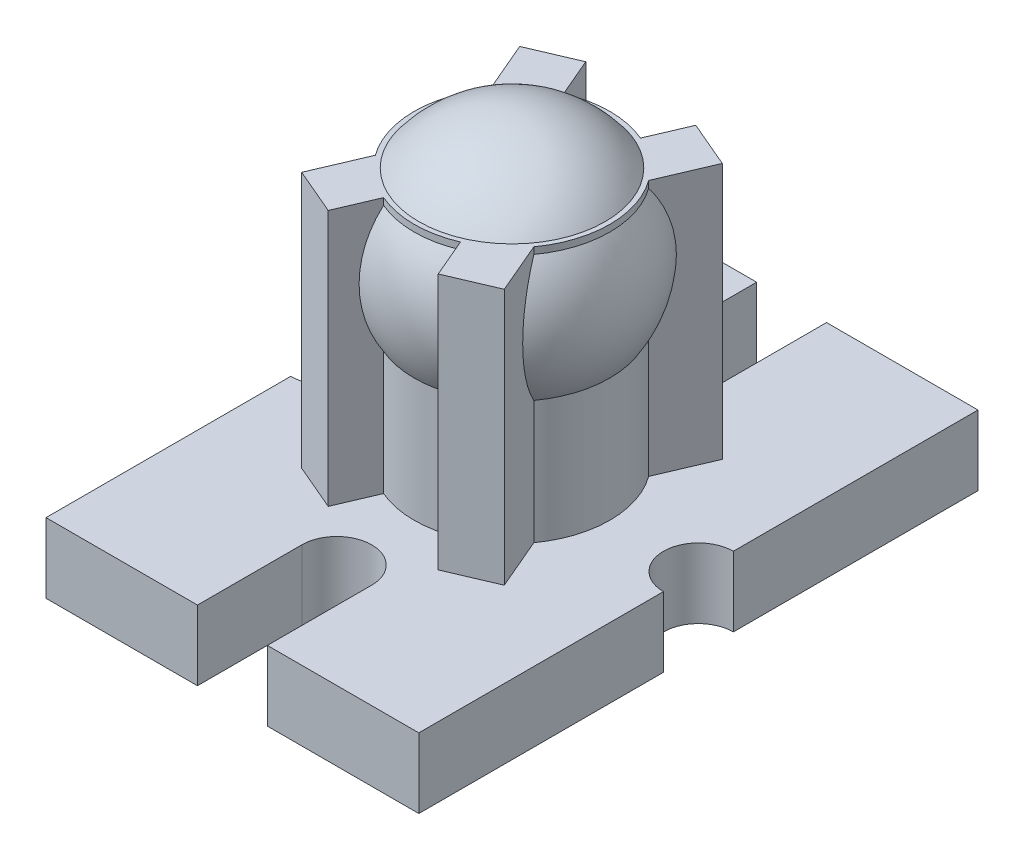
from build123d import *

# Parameters (mm, degrees)
EXTRUDE_1_DEPTH = 3
EXTRUDE_2_DEPTH = 11


with BuildPart() as part:
    # 草图1 → 凸台-拉伸1 (new body)
    with BuildSketch(Plane(origin=(0, 0, 0), x_dir=(1, 0, 0), z_dir=(0, 1, 0))):
        with BuildLine():
            Line((1.5, 12), (8, 12))
            Line((8, 12), (8, 1.5))
            ThreePointArc((8, 1.5), (6.5, 0), (8, -1.5))
            Line((8, -1.5), (8, -12))
            Line((8, -12), (1.5, -12))
            Line((1.5, -12), (1.5, -7.52))
            ThreePointArc((1.5, -7.52), (0, -6.02), (-1.5, -7.52))
            Line((-1.5, -7.52), (-1.5, -12))
            Line((-1.5, -12), (-8, -12))
            Line((-8, -12), (-8, -1.5))
            ThreePointArc((-8, -1.5), (-6.5, 0), (-8, 1.5))
            Line((-8, 1.5), (-8, 12))
            Line((-8, 12), (-1.5, 12))
            Line((-1.5, 12), (-1.5, 7.52))
            ThreePointArc((-1.5, 7.52), (0, 6.02), (1.5, 7.52))
            Line((1.5, 7.52), (1.5, 12))
        make_face()
    extrude(amount=EXTRUDE_1_DEPTH)



with BuildPart() as body_2:
    # 草图2 → 旋转1 (revolve)
    with BuildSketch(Plane(origin=(0, 0, 0), x_dir=(0, 0, -1), z_dir=(1, 0, 0))):
        with BuildLine():
            Line((0, 16), (0, 6))
            ThreePointArc((0, 6), (5, 11), (0, 16))
        make_face()
    revolve(axis=Axis((0, 3, 0), (0, 1, 0)))


with BuildPart() as part_1:
    add(part.part)

    add(body_2.part)  # 凸台-拉伸2 merges body 2
    # 草图3 → 凸台-拉伸2 (add)
    with BuildSketch(Plane(origin=(0, 3, 0), x_dir=(1, 0, 0), z_dir=(0, 1, 0))):
        with BuildLine():
            Line((1.649838457, 3.862386965), (2.360840268, 5.526891824))
            Line((2.360840268, 5.526891824), (4.347210707, 4.678403474))
            Line((4.347210707, 4.678403474), (3.401303107, 2.46396777))
            ThreePointArc((3.401303107, 2.46396777), (4.2, 0), (3.401303107, -2.46396777))
            Line((3.401303107, -2.46396777), (4.347210707, -4.678403474))
            Line((4.347210707, -4.678403474), (2.360840268, -5.526891824))
            Line((2.360840268, -5.526891824), (1.649838457, -3.862386965))
            ThreePointArc((1.649838457, -3.862386965), (0, -4.2), (-1.649838457, -3.862386965))
            Line((-1.649838457, -3.862386965), (-2.360840268, -5.526891824))
            Line((-2.360840268, -5.526891824), (-4.347210707, -4.678403474))
            Line((-4.347210707, -4.678403474), (-3.401303107, -2.46396777))
            ThreePointArc((-3.401303107, -2.46396777), (-4.2, 0), (-3.401303107, 2.46396777))
            Line((-3.401303107, 2.46396777), (-4.347210707, 4.678403474))
            Line((-4.347210707, 4.678403474), (-2.360840268, 5.526891824))
            Line((-2.360840268, 5.526891824), (-1.649838457, 3.862386965))
            ThreePointArc((-1.649838457, 3.862386965), (0, 4.2), (1.649838457, 3.862386965))
        make_face()
    extrude(amount=EXTRUDE_2_DEPTH)


solid = part_1.part
